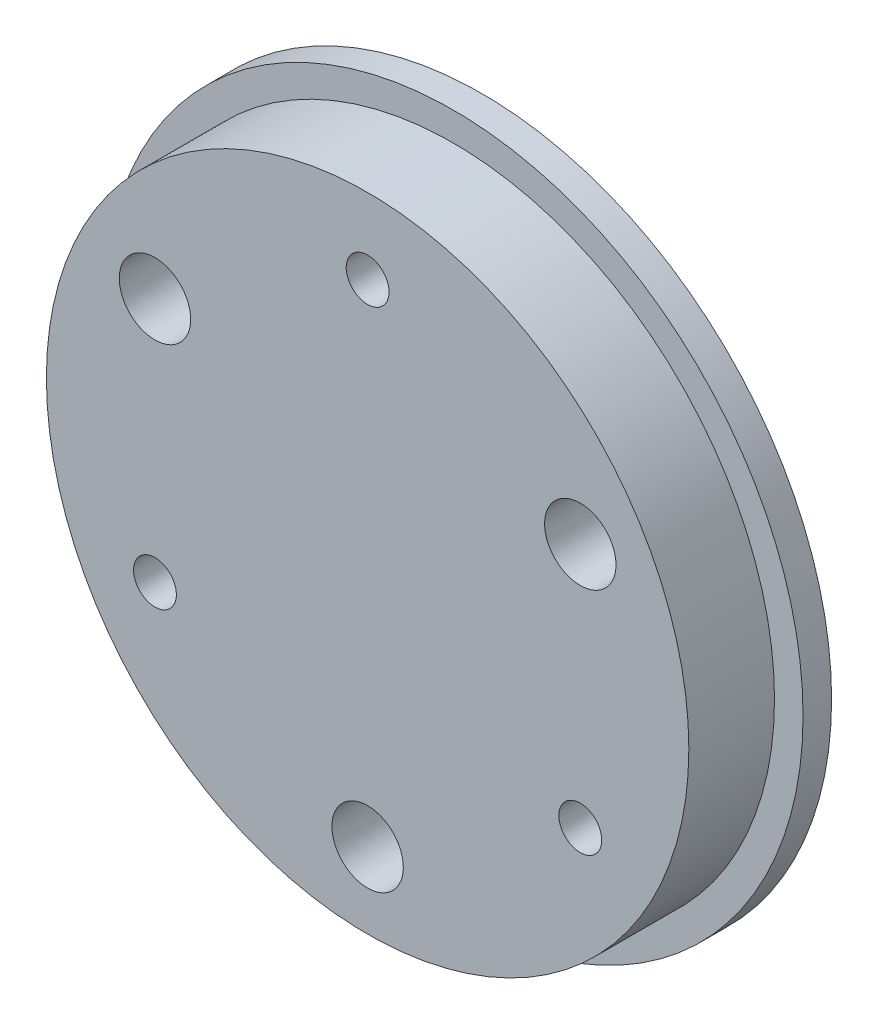
from build123d import *

# Parameters (mm, degrees)
SKETCH1_R           = 24.5
SKETCH1_R_2         = 22.5
BOSS_EXTRUDE1_DEPTH = 2
SKETCH1_3_R         = 22.5
SKETCH1_3_R_2       = 2.5
SKETCH1_3_R_3       = 1.5
BOSS_EXTRUDE2_DEPTH = 8


with BuildPart() as part:
    # Sketch1 → Boss-Extrude1 (new body)
    with BuildSketch(Plane.XY):
        Circle(SKETCH1_R)
        Circle(SKETCH1_R_2, mode=Mode.SUBTRACT)
    extrude(amount=BOSS_EXTRUDE1_DEPTH)

    # Sketch1<3> → Boss-Extrude2 (add)
    with BuildSketch(Plane.XY):
        Circle(SKETCH1_3_R)
        with Locations((0, -17.2)):
            Circle(SKETCH1_3_R_2, mode=Mode.SUBTRACT)
        with Locations((-14.895636945, -8.6)):
            Circle(SKETCH1_3_R_3, mode=Mode.SUBTRACT)
        with Locations((14.895636945, -8.6)):
            Circle(SKETCH1_3_R_3, mode=Mode.SUBTRACT)
        with Locations((-14.895636945, 8.6)):
            Circle(SKETCH1_3_R_2, mode=Mode.SUBTRACT)
        with Locations((0, 17.2)):
            Circle(SKETCH1_3_R_3, mode=Mode.SUBTRACT)
        with Locations((14.895636945, 8.6)):
            Circle(SKETCH1_3_R_2, mode=Mode.SUBTRACT)
    extrude(amount=BOSS_EXTRUDE2_DEPTH)


solid = part.part
